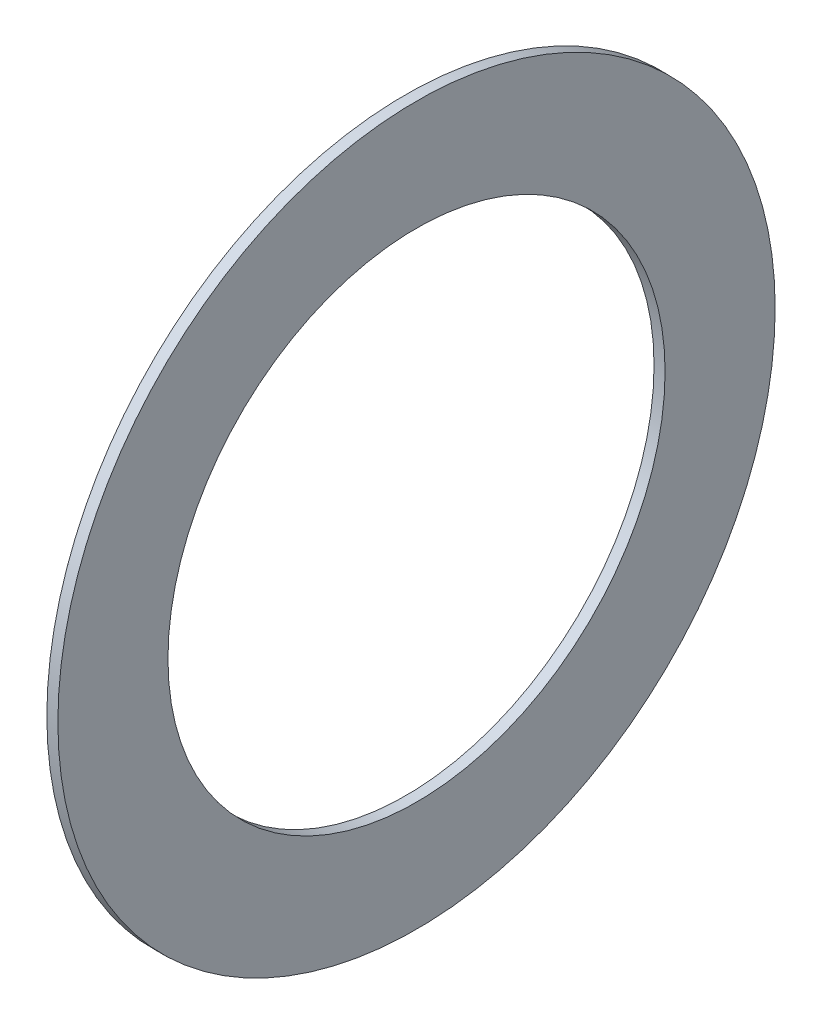
from build123d import *

# Parameters (mm, degrees)
BOSS_EXTRUDE1_DEPTH      = 0.5
BOSS_EXTRUDE1_DEPTH_BACK = 0.5
SKETCH3_R                = 32.5
SKETCH3_R_2              = 22.525


with BuildPart() as part:
    # Sketch3 → Boss-Extrude1 (new, two sides: drawn at the far end of the back side and taken through both)
    with BuildSketch(Plane(origin=(0, 0, 0), x_dir=(0, 0, -1), z_dir=(1, 0, 0)).offset(-BOSS_EXTRUDE1_DEPTH_BACK)):
        Circle(SKETCH3_R)
        Circle(SKETCH3_R_2, mode=Mode.SUBTRACT)
    extrude(amount=BOSS_EXTRUDE1_DEPTH + BOSS_EXTRUDE1_DEPTH_BACK)


solid = part.part
